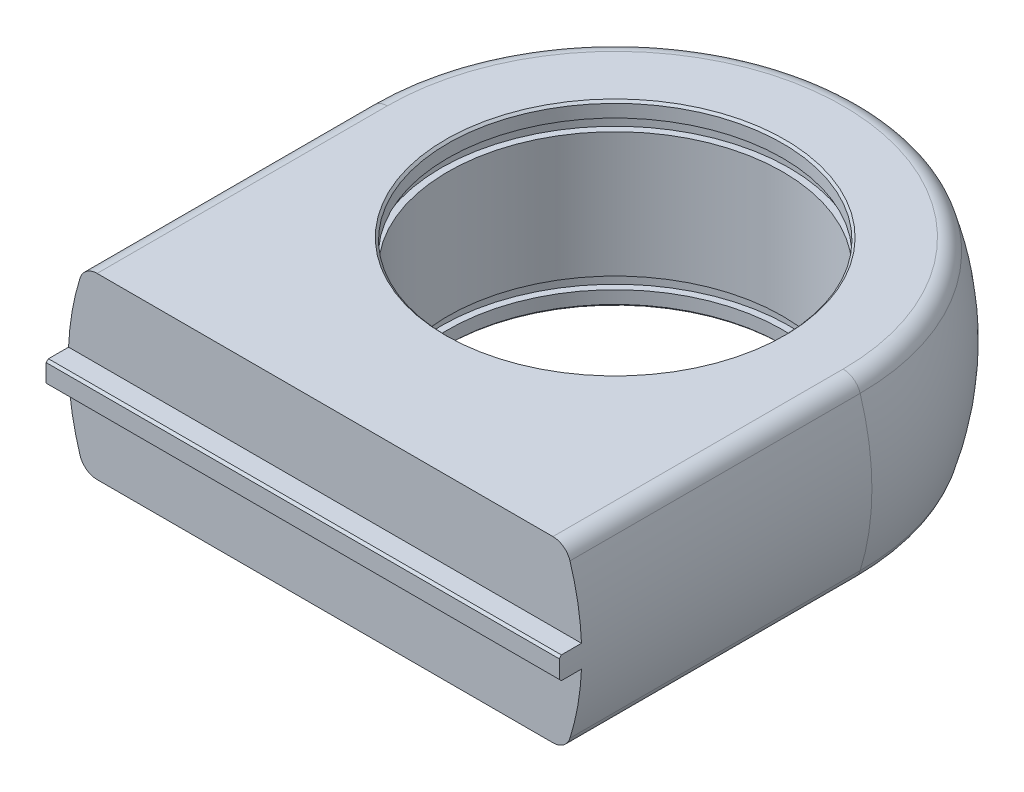
from build123d import *
from build123d.topology import SkipClean

# Parameters (mm, degrees)
SKETCH2_OUTSIDE_W       = 157.722
SKETCH2_OUTSIDE_H       = 157.722
SKETCH2_OUTSIDE_W_2     = 115
SKETCH2_OUTSIDE_H_2     = 40
CUT_EXTRUDE1_DEPTH      = 148.033159525
CUT_EXTRUDE2_DEPTH      = 137.793640203
CUT_EXTRUDE2_DEPTH_BACK = 137.793640203
SKETCH1_4_R             = 37.5
FILLET1_R               = 4
SKETCH3_W               = 1.5
SKETCH3_H               = 2.65
BOSS_EXTRUDE1_DEPTH     = 5
CHAMFER1_SIZE           = 0.5


with BuildPart() as part:
    # Sketch1 → Revolve1 (revolve)
    with BuildSketch(Plane(origin=(0, 0, 0), x_dir=(1, 0, 0), z_dir=(0, 1, 0))):
        with BuildLine():
            Line((57.5, 0), (57.5, 65))
            ThreePointArc((57.5, 65), (40.658639918, 105.658639918), (0, 122.5))
            Line((0, 122.5), (0, 0))
            Line((0, 0), (57.5, 0))
        make_face()
    revolve(axis=Axis((0, 0, 0), (0, 0, -1)))

    # Sketch2 outside → Cut-Extrude1 (cut, through all)
    with BuildSketch(Plane.XY):
        Rectangle(SKETCH2_OUTSIDE_W, SKETCH2_OUTSIDE_H)
        Rectangle(SKETCH2_OUTSIDE_W_2, SKETCH2_OUTSIDE_H_2, mode=Mode.SUBTRACT)
    extrude(amount=-CUT_EXTRUDE1_DEPTH, mode=Mode.SUBTRACT)

    # Sketch1<4> → Cut-Extrude2 (cut, two sides: drawn at the far end of the back side and taken through both)
    with BuildSketch(Plane(origin=(0, 0, 0), x_dir=(1, 0, 0), z_dir=(0, 1, 0)).offset(-CUT_EXTRUDE2_DEPTH_BACK)):
        with Locations((0, 65)):
            Circle(SKETCH1_4_R)
    extrude(amount=CUT_EXTRUDE2_DEPTH + CUT_EXTRUDE2_DEPTH_BACK, mode=Mode.SUBTRACT)

    # Fillet1
    fillet1_edges = [part.edges().sort_by_distance(p)[0] for p in [
        (-53.909646632, -20, -32.5),
        (0, -20, -118.909646632),
        (-53.909646632, 20, -32.5),
        (0, 20, -118.909646632),
        (53.909646632, -20, -32.5),
        (53.909646632, 20, -32.5),
    ]]
    fillet(fillet1_edges, radius=FILLET1_R)

    # Sketch3 → Cut-Revolve1 (revolve, cut)
    with BuildSketch(Plane(origin=(0, 0, 0), x_dir=(0, 0, -1), z_dir=(1, 0, 0))):
        with Locations((103.25, 15.325)):
            Rectangle(SKETCH3_W, SKETCH3_H)
        with Locations((103.25, -15.325)):
            Rectangle(SKETCH3_W, SKETCH3_H)
    revolve(axis=Axis((0, -20, -65), (0, 1, 0)), mode=Mode.SUBTRACT)

    # Sketch4 → Boss-Extrude1 (add)
    with SkipClean():  # the faces are left unmerged after this step: merging them gives an invalid solid
        with BuildSketch(Plane.XY):
            with BuildLine():
                Line((-57.445626465, -2.5), (57.445626465, -2.5))
                ThreePointArc((57.445626465, -2.5), (57.486405007, -1.250295697), (57.5, -1.68e-07))
                ThreePointArc((57.5, -1.68e-07), (57.486405011, 1.250295529), (57.445626465, 2.5))
                Line((57.445626465, 2.5), (-57.445626465, 2.5))
                ThreePointArc((-57.445626465, 2.5), (-57.486405007, 1.250295697), (-57.5, 1.68e-07))
                ThreePointArc((-57.5, 1.68e-07), (-57.486405011, -1.250295529), (-57.445626465, -2.5))
            make_face()
        extrude(amount=BOSS_EXTRUDE1_DEPTH)

    # Chamfer1
    chamfer1_edges = [part.edges().sort_by_distance(p)[0] for p in [
        (0, -2.5, 5),
        (0, 2.5, 5),
        (-37.5, -20, -65),
        (-37.5, 20, -65),
    ]]
    chamfer(chamfer1_edges, length=CHAMFER1_SIZE)


solid = part.part
